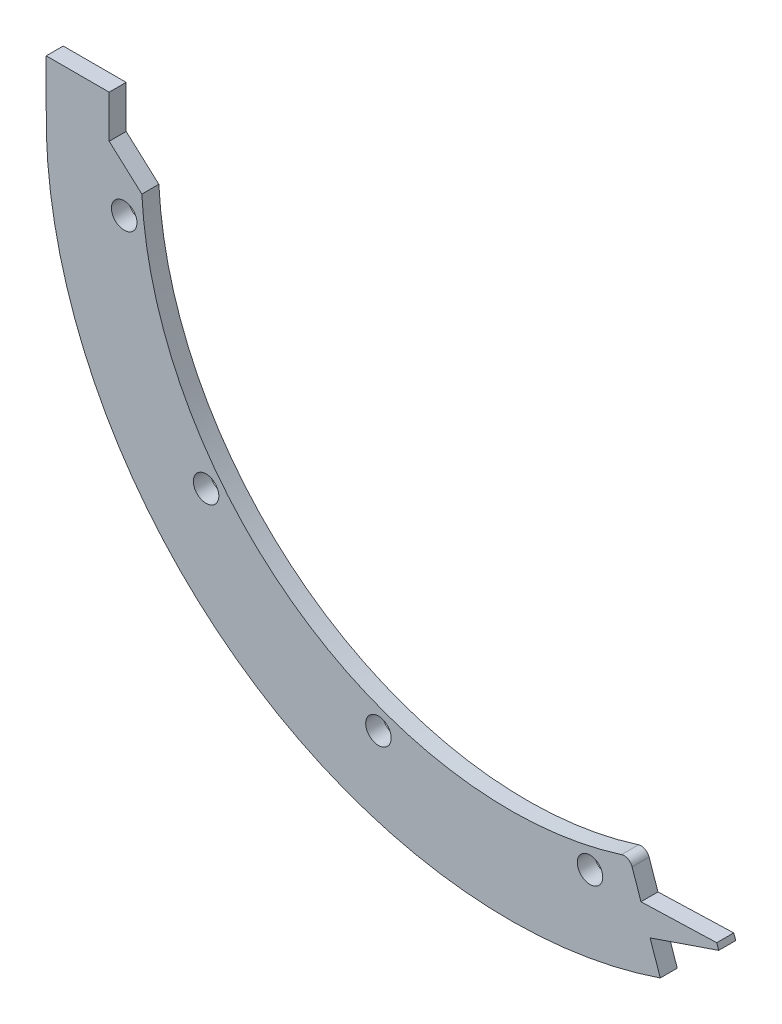
from build123d import *

# Parameters (mm, degrees)
SKETCH1_R           = 1.5
BOSS_EXTRUDE1_DEPTH = 2


with BuildPart() as part:
    # Sketch1 → Boss-Extrude1 (new body)
    with BuildSketch(Plane.XY):
        with BuildLine():
            Line((22.508911342, -130.69915726), (13.597675192, -130.983785211))
            Line((13.597675192, -130.983785211), (12.560733381, -127.954436921))
            ThreePointArc((12.560733381, -127.954436921), (12.064722619, -127.385308804), (11.312186404, -127.325119655))
            ThreePointArc((11.312186404, -127.325119655), (-26.483938318, -121.642871269), (-45.096768624, -88.26027792))
            Line((-45.096768624, -88.26027792), (-48.940455795, -84.8))
            Line((-48.940455795, -84.8), (-48.940455795, -79.8))
            Line((-48.940455795, -79.8), (-56.342527733, -79.8))
            Line((-56.342527733, -79.8), (-56.342527733, -84.8))
            ThreePointArc((-56.342527733, -84.8), (-34.007319131, -130.034150274), (15.867669408, -137.615404294))
            Line((15.867669408, -137.615404294), (14.673679255, -134.127250965))
            Line((14.673679255, -134.127250965), (22.749464344, -131.362920683))
            Line((22.749464344, -131.362920683), (22.508911342, -130.69915726))
        make_face()
        with Locations((7.607262335, -130.722795016)):
            Circle(SKETCH1_R, mode=Mode.SUBTRACT)
        with Locations((-37.543895432, -114.478381178)):
            Circle(SKETCH1_R, mode=Mode.SUBTRACT)
        with Locations((-47.172740285, -91.473829097)):
            Circle(SKETCH1_R, mode=Mode.SUBTRACT)
        with Locations((-17.271773957, -129.003020951)):
            Circle(SKETCH1_R, mode=Mode.SUBTRACT)
    extrude(amount=BOSS_EXTRUDE1_DEPTH)


solid = part.part
